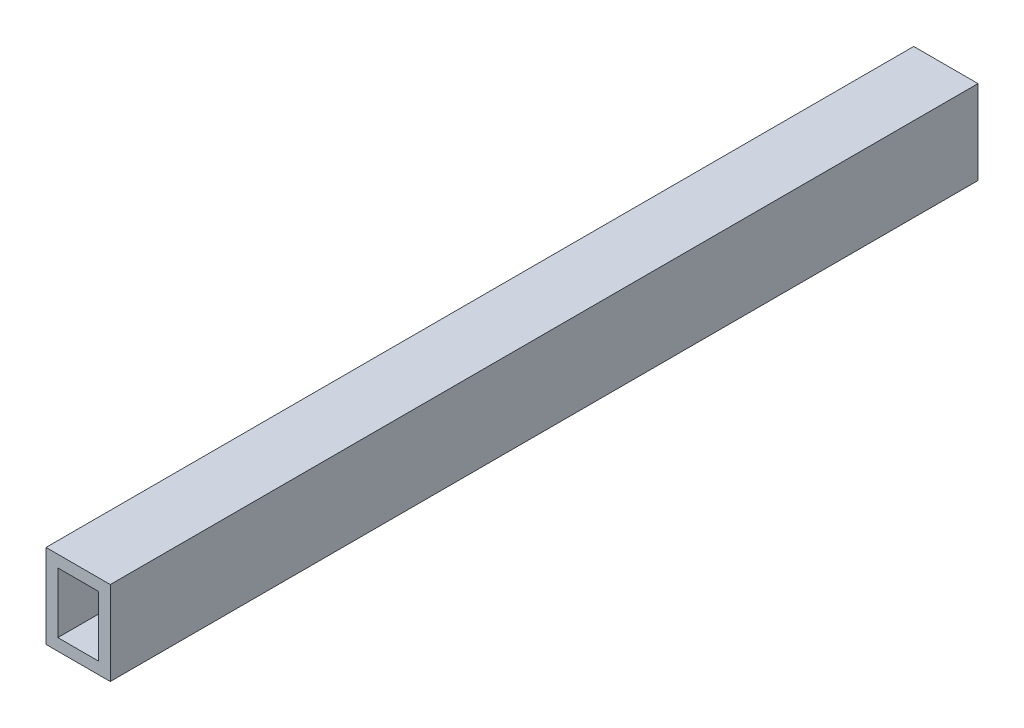
from build123d import *

# Parameters (mm, degrees)
SKETCH_1_W      = 16.3
SKETCH_1_H      = 21.3
SKETCH_1_W_2    = 10.3
SKETCH_1_H_2    = 15.3
EXTRUDE_1_DEPTH = 220


with BuildPart() as part:
    # 草图1 → 凸台-拉伸1 (new body)
    with BuildSketch(Plane.XY):
        Rectangle(SKETCH_1_W, SKETCH_1_H)
        Rectangle(SKETCH_1_W_2, SKETCH_1_H_2, mode=Mode.SUBTRACT)
    extrude(amount=EXTRUDE_1_DEPTH)


solid = part.part
